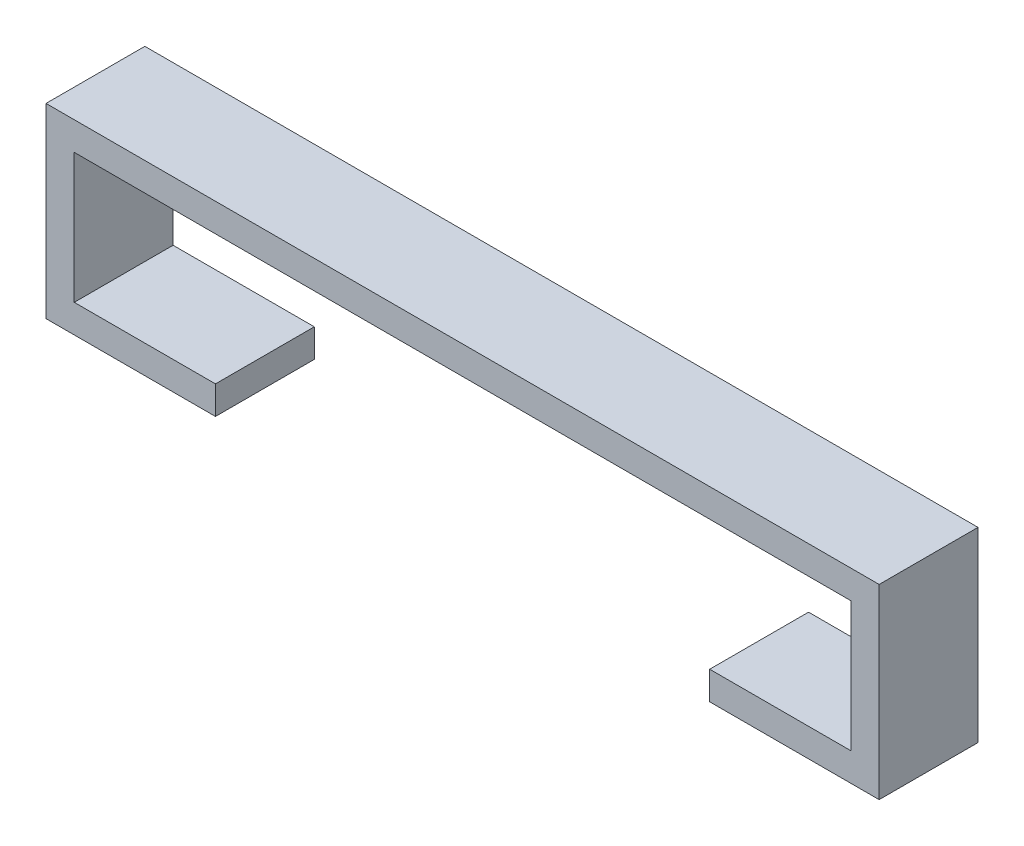
from build123d import *

# Parameters (mm, degrees)
BOSS_EXTRUDE1_DEPTH = 7


with BuildPart() as part:
    # Sketch1 → Boss-Extrude1 (new body)
    with BuildSketch(Plane.XY):
        Polygon((-29.5, 13.2), (29.5, 13.2), (29.5, 0), (17.5, 0), (17.5, 2), (27.5, 2), (27.5, 11.2), (-27.5, 11.2), (-27.5, 2), (-17.5, 2), (-17.5, 0), (-29.5, 0), align=None)
    extrude(amount=BOSS_EXTRUDE1_DEPTH)


solid = part.part
